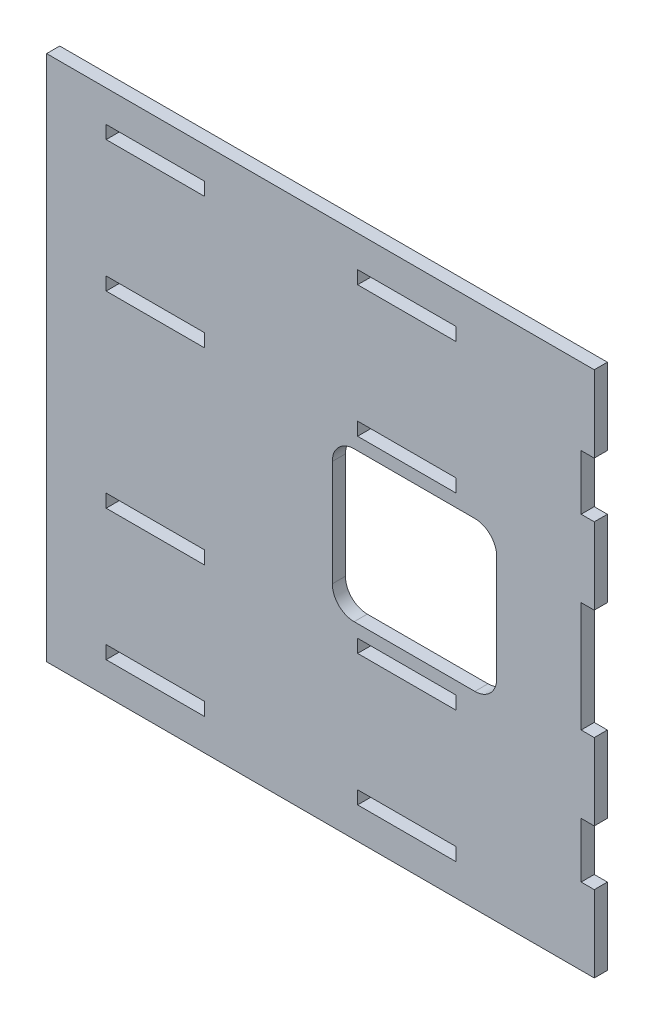
from build123d import *

# Parameters (mm, degrees)
SKETCH1_W           = 45
SKETCH1_H           = 6
BOSS_EXTRUDE1_DEPTH = 6


with BuildPart() as part:
    # Sketch1 → Boss-Extrude1 (new body)
    with BuildSketch(Plane.XY):
        Polygon((127.972610893, -160.108528092), (-86.474936563, -160.108528092), (-86.474936563, -401.007755411), (127.972610893, -401.007755411), (157.972610893, -401.007755411), (163.972610893, -401.007755411), (163.972610893, -366.007755411), (157.972610893, -366.007755411), (157.972610893, -340.782948582), (163.972610893, -340.782948582), (163.972610893, -305.782948582), (157.972610893, -305.782948582), (157.972610893, -255.333334922), (163.972610893, -255.333334922), (163.972610893, -220.333334922), (157.972610893, -220.333334922), (157.972610893, -195.108528092), (163.972610893, -195.108528092), (163.972610893, -160.108528092), (157.972610893, -160.108528092), align=None)
        with Locations((-36.751162835, -237.558141752)):
            Rectangle(SKETCH1_W, SKETCH1_H, mode=Mode.SUBTRACT)
        with Locations((78.248837165, -237.558141752)):
            Rectangle(SKETCH1_W, SKETCH1_H, mode=Mode.SUBTRACT)
        with Locations((-36.751162835, -177.558141752)):
            Rectangle(SKETCH1_W, SKETCH1_H, mode=Mode.SUBTRACT)
        with Locations((78.248837165, -177.558141752)):
            Rectangle(SKETCH1_W, SKETCH1_H, mode=Mode.SUBTRACT)
        with Locations((-36.751162835, -383.558141752)):
            Rectangle(SKETCH1_W, SKETCH1_H, mode=Mode.SUBTRACT)
        with Locations((78.248837165, -383.558141752)):
            Rectangle(SKETCH1_W, SKETCH1_H, mode=Mode.SUBTRACT)
        with Locations((78.248837165, -323.558141752)):
            Rectangle(SKETCH1_W, SKETCH1_H, mode=Mode.SUBTRACT)
        with Locations((-36.751162835, -323.558141752)):
            Rectangle(SKETCH1_W, SKETCH1_H, mode=Mode.SUBTRACT)
        with BuildLine():
            Line((54.167727184, -246.324076289), (109.370044405, -246.324076289))
            ThreePointArc((109.370044405, -246.324076289), (116.441112216, -249.253008477), (119.370044405, -256.324076289))
            Line((119.370044405, -256.324076289), (119.370044405, -304.792207215))
            ThreePointArc((119.370044405, -304.792207215), (116.441112216, -311.863275027), (109.370044405, -314.792207215))
            Line((109.370044405, -314.792207215), (54.167727184, -314.792207215))
            ThreePointArc((54.167727184, -314.792207215), (47.096659372, -311.863275027), (44.167727184, -304.792207215))
            Line((44.167727184, -304.792207215), (44.167727184, -256.324076289))
            ThreePointArc((44.167727184, -256.324076289), (47.096659372, -249.253008477), (54.167727184, -246.324076289))
        make_face(mode=Mode.SUBTRACT)
    extrude(amount=BOSS_EXTRUDE1_DEPTH)


solid = part.part
